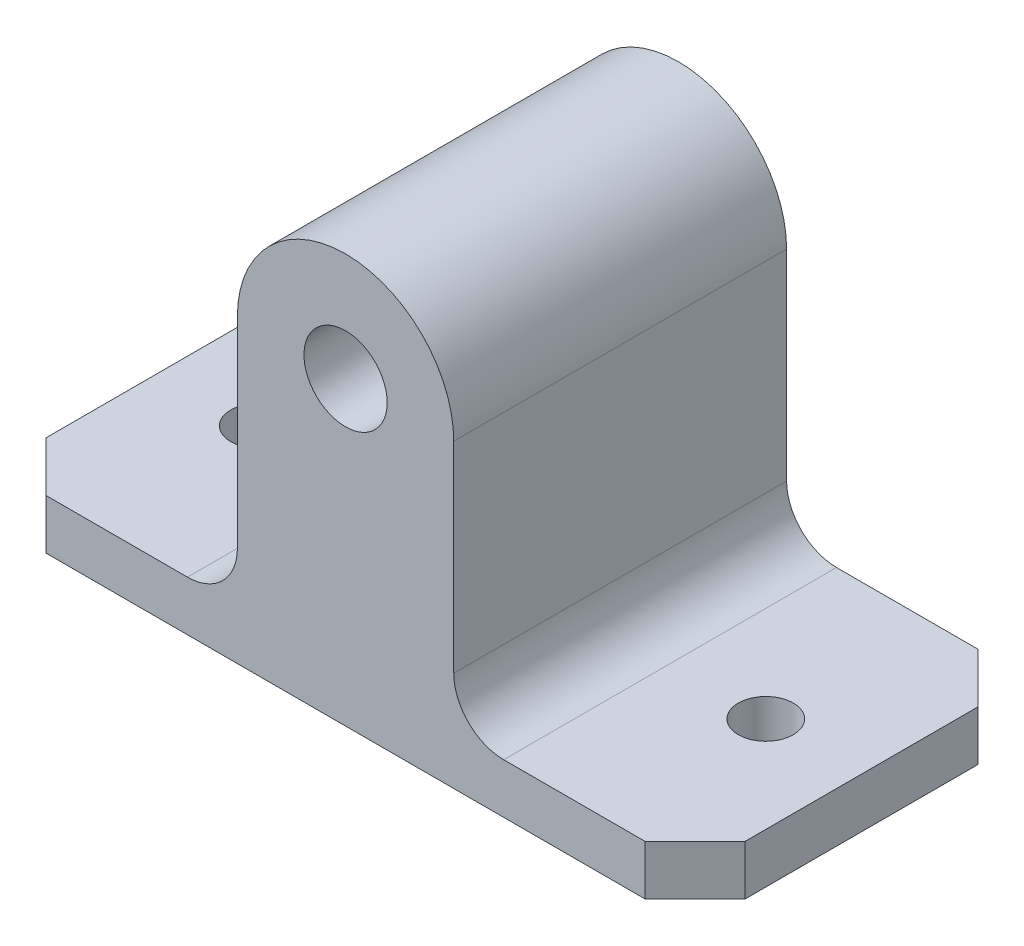
from build123d import *

# Parameters (mm, degrees)
SKETCH1_R           = 2.5
BOSS_EXTRUDE1_DEPTH = 20
CHAMFER1_SIZE       = 3
SKETCH2_R           = 1.65
CUT_EXTRUDE1_DEPTH  = 20


with BuildPart() as part:
    # Sketch1 → Boss-Extrude1 (new body)
    with BuildSketch(Plane.XY):
        with BuildLine():
            Line((-21, -18.072367328), (21, -18.072367328))
            Line((21, -18.072367328), (21, -15.072367328))
            Line((21, -15.072367328), (9.5, -15.072367328))
            ThreePointArc((9.5, -15.072367328), (7.378679656, -14.193687672), (6.5, -12.072367328))
            Line((6.5, -12.072367328), (6.5, 0))
            ThreePointArc((6.5, 0), (0, 6.5), (-6.5, 0))
            Line((-6.5, 0), (-6.5, -12.072367328))
            ThreePointArc((-6.5, -12.072367328), (-7.378679656, -14.193687672), (-9.5, -15.072367328))
            Line((-9.5, -15.072367328), (-21, -15.072367328))
            Line((-21, -15.072367328), (-21, -18.072367328))
        make_face()
        Circle(SKETCH1_R, mode=Mode.SUBTRACT)
    extrude(amount=BOSS_EXTRUDE1_DEPTH)

    # Chamfer1
    chamfer1_edges = [part.edges().sort_by_distance(p)[0] for p in [
        (21, -16.572367328, 20),
        (21, -16.572367328, 0),
        (-21, -16.572367328, 0),
        (-21, -16.572367328, 20),
    ]]
    chamfer(chamfer1_edges, length=CHAMFER1_SIZE)

    # Sketch2 → Cut-Extrude1 (cut)
    with BuildSketch(Plane(origin=(0, -15.072367328, 0), x_dir=(1, 0, 0), z_dir=(0, 1, 0))):
        with Locations(Location((15.25, -10, 0), (0, 0, 180))):
            Circle(SKETCH2_R)
        with Locations(Location((-15.25, -10, 0), (0, 0, 180))):
            Circle(SKETCH2_R)
    extrude(amount=-CUT_EXTRUDE1_DEPTH, mode=Mode.SUBTRACT)


solid = part.part
